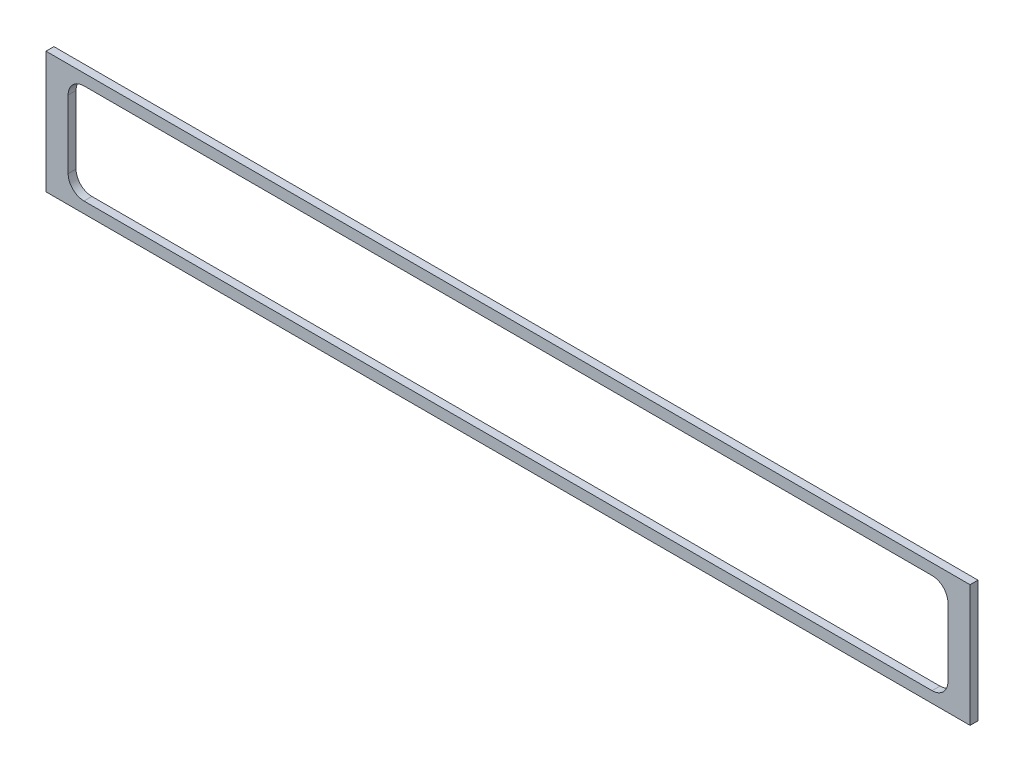
from build123d import *

# Parameters (mm, degrees)
SZKIC1_W                    = 584
SZKIC1_H                    = 77
DODANIE_WYCI_GNI_CIE1_DEPTH = 5
WYTNIJ_WYCI_GNI_CIE1_DEPTH  = 5


with BuildPart() as part:
    # Szkic1 → Dodanie-wyciągnięcie1 (new body)
    with BuildSketch(Plane.XY):
        with Locations((16.803474484, 79.758414767)):
            Rectangle(SZKIC1_W, SZKIC1_H)
    extrude(amount=DODANIE_WYCI_GNI_CIE1_DEPTH)

    # Szkic2 → Wytnij-wyciągnięcie1 (cut)
    with BuildSketch(Plane.XY.offset(5)):
        with BuildLine():
            Line((-251.196525516, 111.258414767), (284.803474484, 111.258414767))
            ThreePointArc((284.803474484, 111.258414767), (291.874542296, 108.329482578), (294.803474484, 101.258414767))
            Line((294.803474484, 101.258414767), (294.803474484, 58.258414767))
            ThreePointArc((294.803474484, 58.258414767), (291.874542296, 51.187346955), (284.803474484, 48.258414767))
            Line((284.803474484, 48.258414767), (-251.196525516, 48.258414767))
            ThreePointArc((-251.196525516, 48.258414767), (-258.267593328, 51.187346955), (-261.196525516, 58.258414767))
            Line((-261.196525516, 58.258414767), (-261.196525516, 101.258414767))
            ThreePointArc((-261.196525516, 101.258414767), (-258.267593328, 108.329482578), (-251.196525516, 111.258414767))
        make_face()
    extrude(amount=-WYTNIJ_WYCI_GNI_CIE1_DEPTH, mode=Mode.SUBTRACT)


solid = part.part
